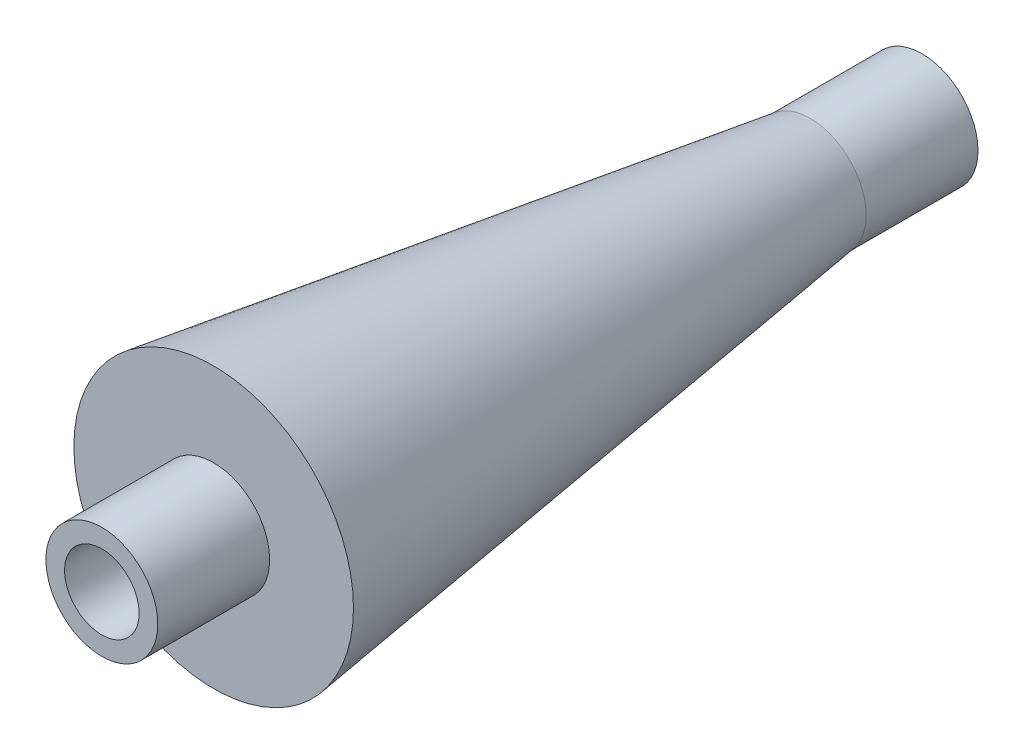
from build123d import *


with BuildPart() as part:
    # Sketch1 → Revolve1 (revolve)
    with BuildSketch(Plane(origin=(0, 0, 0), x_dir=(1, 0, 0), z_dir=(0, 1, 0))):
        Polygon((3.175, 14.443299572), (3.175, 84.293299572), (4.7625, 84.293299572), (4.7625, 74.768299572), (11.90625, 23.968299572), (4.7625, 23.968299572), (4.7625, 14.443299572), align=None)
    revolve(axis=Axis((0, 0, 1.5875), (0, 0, -1)))


solid = part.part
